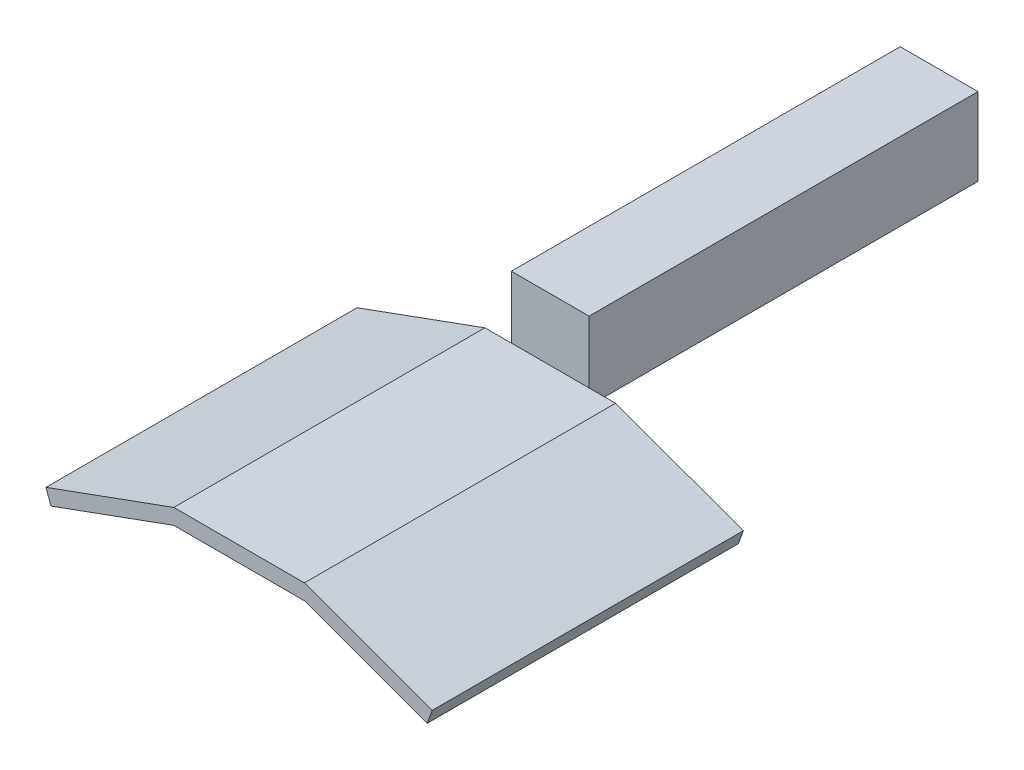
from build123d import *

# Parameters (mm, degrees)
SKETCH1_W           = 100
SKETCH1_H           = 100
BOSS_EXTRUDE1_DEPTH = 500
SKETCH2_W           = 168
SKETCH2_H           = 20
BOSS_EXTRUDE2_DEPTH = 400
BOSS_EXTRUDE3_DEPTH = 400


with BuildPart() as part:
    # Sketch1 → Boss-Extrude1 (new body)
    with BuildSketch(Plane.XY):
        with Locations((50, 50)):
            Rectangle(SKETCH1_W, SKETCH1_H)
    extrude(amount=BOSS_EXTRUDE1_DEPTH)

    # Sketch2 → Boss-Extrude2 (add)
    with BuildSketch(Plane.XY.offset(500)):
        with Locations((50, 10)):
            Rectangle(SKETCH2_W, SKETCH2_H)
    extrude(amount=BOSS_EXTRUDE2_DEPTH)

    # Sketch3 → Boss-Extrude3 (add)
    with BuildSketch(Plane.XY.offset(900)):
        Polygon((134, 0), (291.868360292, -57.459384079), (298.296236389, -39.798939648), (134, 20), align=None)
        Polygon((-198.296236389, -39.798939648), (-34, 20), (-34, 0), (-191.868360292, -57.459384079), align=None)
    extrude(amount=-BOSS_EXTRUDE3_DEPTH)


solid = part.part
